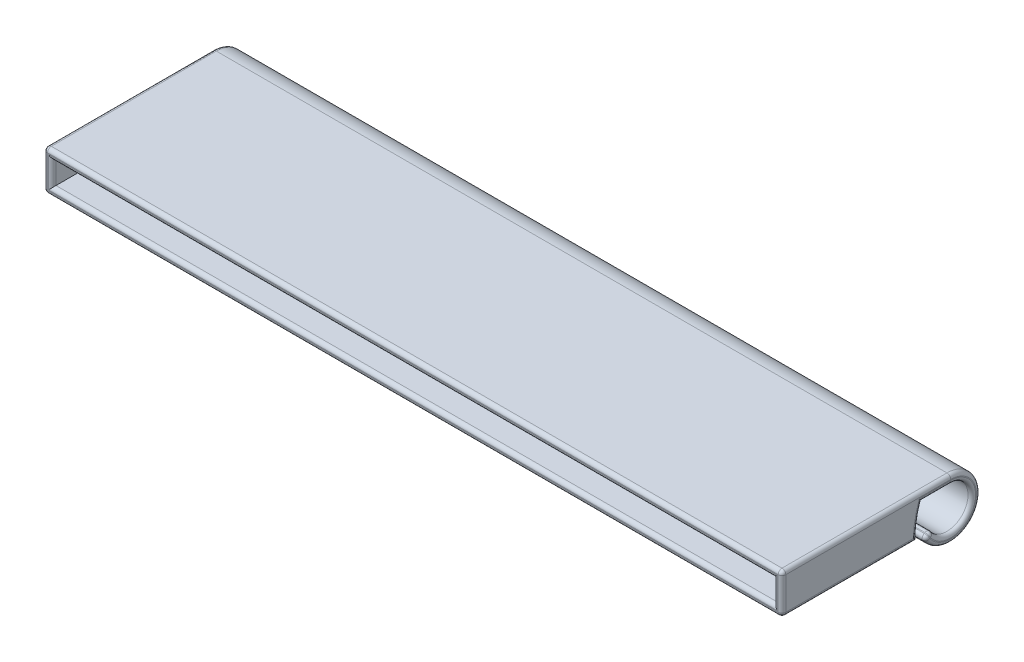
from build123d import *

# Parameters (mm, degrees)
BOSS_EXTRUDE1_DEPTH             = 8.75
BOSS_EXTRUDE2_DEPTH             = 0.2
BOSS_EXTRUDE3_REACH             = 12.005
SKETCH4_W                       = 3.173679441
SKETCH4_H                       = 0.2
BOSS_EXTRUDE3_DIRECTION_2_REACH = 12.005
FILLET1_R                       = 0.09


with BuildPart() as part:
    # Sketch2 → Boss-Extrude1 (new, symmetric)
    with BuildSketch(Plane(origin=(0, 0, 0), x_dir=(0, 0, -1), z_dir=(1, 0, 0))):
        with BuildLine():
            Line((0, 0), (4, 0))
            ThreePointArc((4, 0), (4.425963639, -0.761830056), (3.553879666, -0.725780087))
            Line((3.553879666, -0.725780087), (3.375431533, -0.816092122))
            ThreePointArc((3.375431533, -0.816092122), (4.596349095, -0.866562078), (4, 0.2))
            Line((4, 0.2), (0, 0.2))
            Line((0, 0.2), (0, 0))
        make_face()
    extrude(amount=BOSS_EXTRUDE1_DEPTH, both=True)

    # Sketch3 → Boss-Extrude2 (add)
    with BuildSketch(Plane(origin=(8.75, 0, 0), x_dir=(0, 0, -1), z_dir=(1, 0, 0))):
        with BuildLine():
            Line((0, 0), (0, -0.749873542))
            Line((0, -0.749873542), (3.199706895, -0.749873542))
            ThreePointArc((3.199706895, -0.749873542), (3.230171613, -0.370080622), (3.320786706, 0))
            Line((3.320786706, 0), (0, 0))
        make_face()
    boss_extrude2 = extrude(amount=-BOSS_EXTRUDE2_DEPTH)

    # Mirror1: Boss-Extrude2 across plane
    add(boss_extrude2.mirror(Plane(origin=(0, 0, 0), x_dir=(0, 0, 1), z_dir=(1, 0, 0))))

    # Boss-Extrude3: up to this face of the body (flat: up to its plane)
    boss_extrude3_end = Plane(part.part.faces().sort_by_distance((8.55, -0.372613624, -1.620023342))[0])
    # Sketch4 → Boss-Extrude3 (add, up to the picked face)
    with BuildSketch(Plane(origin=(0, 0, 0), x_dir=(0, 0, -1), z_dir=(1, 0, 0)), mode=Mode.PRIVATE) as boss_extrude3_sk1:
        with Locations((1.58683972, -0.649873542)):
            Rectangle(SKETCH4_W, SKETCH4_H)
    boss_extrude3_tool1 = split(extrude(boss_extrude3_sk1.sketch, amount=BOSS_EXTRUDE3_REACH, mode=Mode.PRIVATE), bisect_by=boss_extrude3_end, keep=Keep.BOTH, mode=Mode.PRIVATE)
    add(boss_extrude3_tool1.solids().sort_by(Axis((0, -0.649874, -1.58684), (1, 0, 0)))[0])

    # Boss-Extrude3 direction 2: up to this face of the body (flat: up to its plane)
    boss_extrude3_direction_2_end = Plane(part.part.faces().sort_by_distance((-8.55, -0.372613624, -1.620023342))[0])
    # Sketch4 → Boss-Extrude3 direction 2 (add, up to the picked face)
    with BuildSketch(Plane(origin=(0, 0, 0), x_dir=(0, 0, -1), z_dir=(1, 0, 0)), mode=Mode.PRIVATE) as boss_extrude3_direction_2_sk1:
        with Locations((1.58683972, -0.649873542)):
            Rectangle(SKETCH4_W, SKETCH4_H)
    boss_extrude3_direction_2_tool1 = split(extrude(boss_extrude3_direction_2_sk1.sketch, amount=-BOSS_EXTRUDE3_DIRECTION_2_REACH, mode=Mode.PRIVATE), bisect_by=boss_extrude3_direction_2_end, keep=Keep.BOTH, mode=Mode.PRIVATE)
    add(boss_extrude3_direction_2_tool1.solids().sort_by(Axis((0, -0.649874, -1.58684), (-1, 0, 0)))[0])

    # Fillet1
    fillet1_edges = [part.edges().sort_by_distance(p)[0] for p in [
        (0, 0.2, 0),
        (0, -0.816092122, -3.375431533),
        (0, -0.725780087, -3.553879666),
        (8.75, -0.761830056, -4.425963639),
        (8.75, -0.770936105, -3.4646556),
        (8.75, 0, -3.660393353),
        (0, 0, 0),
        (8.75, -0.866562078, -4.596349095),
        (8.55, -0.274936771, 0),
        (0, -0.749873542, 0),
        (8.75, -0.749873542, -1.599853447),
        (8.75, -0.370080622, -3.230171613),
        (8.75, 0.2, -2),
        (-8.75, 0, -3.660393353),
        (-8.75, -0.749873542, -1.599853447),
        (-8.75, -0.370080622, -3.230171613),
        (-8.55, -0.274936771, 0),
        (0, -0.549873542, 0),
        (8.75, -0.274936771, 0),
        (-8.75, 0.2, -2),
        (-8.75, -0.866562078, -4.596349095),
        (-8.75, -0.770936105, -3.4646556),
        (-8.75, -0.761830056, -4.425963639),
        (-8.75, -0.274936771, 0),
    ]]
    fillet(fillet1_edges, radius=FILLET1_R)


solid = part.part
